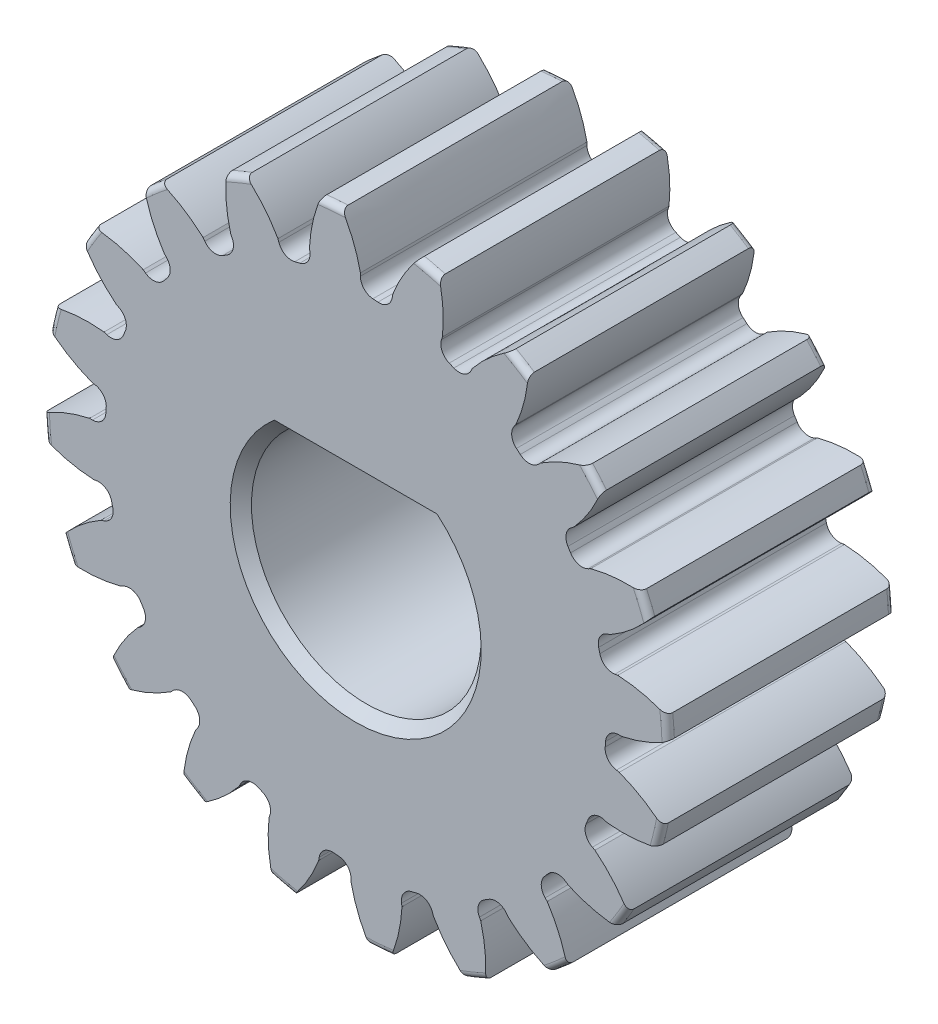
from build123d import *

# Parameters (mm, degrees)
SKETCH1_R                = 8.763
BOSS_EXTRUDE1_DEPTH      = 6.35
SKETCH2_W                = 6.3627
SKETCH2_H                = 5.953125
FILLET2_R                = 0.17526
CUT_EXTRUDE1_DEPTH       = 17.653840842
FILLET1_R                = 0.37404675
CIRPATTERN1_COUNT        = 20
FILLET1_OF_CIRPATTERN1_R = 0.37404675
CUT_EXTRUDE2_DEPTH       = 17.644788953
CHAMFER1_SIZE            = 0.29765625
SKETCH6_R                = 6.35
CUT_EXTRUDE3_DEPTH       = 4.7752


with BuildPart() as part:
    # Sketch1 → Boss-Extrude1 (new body)
    with BuildSketch(Plane.XY):
        Circle(SKETCH1_R)
    extrude(amount=-BOSS_EXTRUDE1_DEPTH)

    # Sketch2 → Revolve1 (revolve)
    with BuildSketch(Plane(origin=(0, 0, 0), x_dir=(0, 0, -1), z_dir=(1, 0, 0)), mode=Mode.PRIVATE) as revolve1_sk:
        with Locations((7.94385, 2.9765625)):
            Rectangle(SKETCH2_W, SKETCH2_H)
    revolve(revolve1_sk.sketch.rotate(Axis((0, 0, -4.7625), (0, 0, -1)), 90), axis=Axis((0, 0, -4.7625), (0, 0, -1)))

    # Fillet2
    fillet2_edges = [part.edges().sort_by_distance(p)[0] for p in [
        (-8.763, 0, 0),
        (-8.763, 0, -6.35),
        (-5.953125, 0, -6.35),
    ]]
    fillet(fillet2_edges, radius=FILLET2_R)

    # Sketch4 → Cut-Extrude1 (cut, through all)
    with BuildSketch(Plane.XY):
        with BuildLine():
            Line((0.131764687, 7.457646233), (0.131764687, 7.017894383))
            ThreePointArc((0.131764687, 7.017894383), (0.550715976, 6.99749351), (0.967700662, 6.952104641))
            Line((0.967700662, 6.952104641), (1.036493167, 7.38644239))
            add(Edge.make_bspline(
                [(3.690312257, 9.886935858), (1.697229771, 9.111844986), (1.036493167, 7.38644239)],
                knots=[0, 0, 0, 1, 1, 1], degree=2))
            ThreePointArc((3.690312257, 9.886935858), (0.827995997, 10.520661949), (-2.098217069, 10.342504066))
            add(Edge.make_bspline(
                [(-2.098217069, 10.342504066), (-0.250924056, 9.265168378), (0.131764687, 7.457646233)],
                knots=[0, 0, 0, 1, 1, 1], degree=2))
        make_face()
    cut_extrude1 = extrude(amount=-CUT_EXTRUDE1_DEPTH, mode=Mode.SUBTRACT)

    # Fillet1
    fillet1_edges = [part.edges().sort_by_distance(p)[0] for p in [
        (0.967700662, 6.952104641, -3.175),
        (0.131764687, 7.017894383, -3.175),
    ]]
    fillet(fillet1_edges, radius=FILLET1_R)

    # CirPattern1: Cut-Extrude1 ×20 about axis
    cirpattern1_axis = Axis((0, 0, -6.35), (0, 0, 1))
    for i in range(1, CIRPATTERN1_COUNT):
        add(cut_extrude1.rotate(cirpattern1_axis, i * 360 / CIRPATTERN1_COUNT), mode=Mode.SUBTRACT)

    # Fillet1 of CirPattern1
    fillet1_of_cirpattern1_edges = [part.edges().sort_by_distance(p)[0] for p in [
        (-1.22798046, 6.91088037, -3.175),
        (-2.043332965, 6.715131711, -3.175),
        (-3.303458299, 6.193170979, -3.175),
        (-4.01841495, 5.75504516, -3.175),
        (-5.055570623, 4.869230861, -3.175),
        (-5.600146481, 4.231614691, -3.175),
        (-6.31280847, 3.068656501, -3.175),
        (-6.633696656, 2.293964293, -3.175),
        (-6.952104641, 0.967700662, -3.175),
        (-7.017894383, 0.131764687, -3.175),
        (-6.91088037, -1.22798046, -3.175),
        (-6.715131711, -2.043332965, -3.175),
        (-6.193170979, -3.303458299, -3.175),
        (-5.75504516, -4.01841495, -3.175),
        (-4.869230861, -5.055570623, -3.175),
        (-4.231614691, -5.600146481, -3.175),
        (-3.068656501, -6.31280847, -3.175),
        (-2.293964293, -6.633696656, -3.175),
        (-0.967700662, -6.952104641, -3.175),
        (-0.131764687, -7.017894383, -3.175),
        (1.22798046, -6.91088037, -3.175),
        (2.043332965, -6.715131711, -3.175),
        (3.303458299, -6.193170979, -3.175),
        (4.01841495, -5.75504516, -3.175),
        (5.055570623, -4.869230861, -3.175),
        (5.600146481, -4.231614691, -3.175),
        (6.31280847, -3.068656501, -3.175),
        (6.633696656, -2.293964293, -3.175),
        (6.952104641, -0.967700662, -3.175),
        (7.017894383, -0.131764687, -3.175),
        (6.91088037, 1.22798046, -3.175),
        (6.715131711, 2.043332965, -3.175),
        (6.193170979, 3.303458299, -3.175),
        (5.75504516, 4.01841495, -3.175),
        (4.869230861, 5.055570623, -3.175),
        (4.231614691, 5.600146481, -3.175),
        (3.068656501, 6.31280847, -3.175),
        (2.293964293, 6.633696656, -3.175),
    ]]
    fillet(fillet1_of_cirpattern1_edges, radius=FILLET1_OF_CIRPATTERN1_R)

    # Sketch5 → Cut-Extrude2 (cut, through all)
    with BuildSketch(Plane.XY):
        with BuildLine():
            Line((0, 2.38125), (-2.166681043, 2.38125))
            ThreePointArc((-2.166681043, 2.38125), (-3.002596677, -1.161581463), (0, -3.21945))
            Line((0, -3.21945), (0, 2.38125))
        make_face()
        with BuildLine():
            Line((2.166681043, 2.38125), (0, 2.38125))
            Line((0, 2.38125), (0, -3.21945))
            ThreePointArc((0, -3.21945), (2.276494927, -2.276494927), (3.21945, 0))
            ThreePointArc((3.21945, 0), (2.944518601, 1.301794342), (2.166681043, 2.38125))
        make_face()
    extrude(amount=-CUT_EXTRUDE2_DEPTH, mode=Mode.SUBTRACT)

    # Chamfer1
    chamfer1_edges = [part.edges().sort_by_distance(p)[0] for p in [
        (-5.953125, 0, -11.1252),
        (0, -3.21945, -11.1252),
        (0, 2.38125, 0),
        (0, -3.21945, 0),
    ]]
    chamfer(chamfer1_edges, length=CHAMFER1_SIZE)

    # Sketch6 → Cut-Extrude3 (cut)
    with BuildSketch(Plane(origin=(0, 0, -11.1252), x_dir=(-1, 0, 0), z_dir=(0, 0, -1))):
        Circle(SKETCH6_R)
    extrude(amount=-CUT_EXTRUDE3_DEPTH, mode=Mode.SUBTRACT)


solid = part.part
